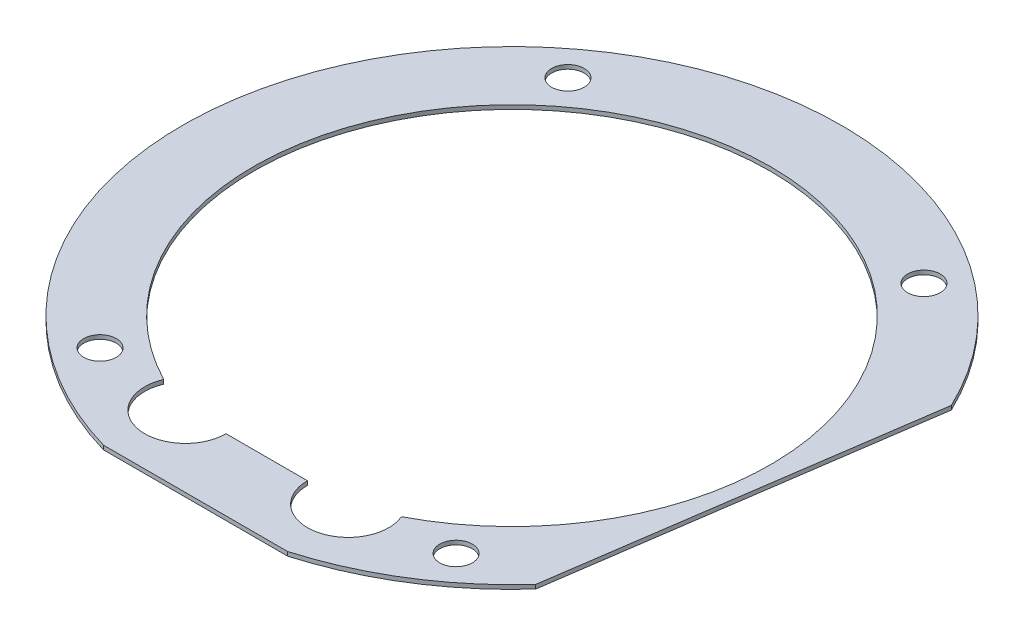
from build123d import *

# Parameters (mm, degrees)
SKETCH1_R           = 1.6
BOSS_EXTRUDE1_DEPTH = 0.4


with BuildPart() as part:
    # Sketch1 → Boss-Extrude1 (new body)
    with BuildSketch(Plane(origin=(0, 0, 0), x_dir=(1, 0, 0), z_dir=(0, 1, 0))):
        with BuildLine():
            Line((29.237843605, 13.960963482), (24.049079653, -21.711788683))
            ThreePointArc((24.049079653, -21.711788683), (17.208573183, -27.452231403), (9.060814288, -31.107260317))
            Line((9.060814288, -31.107260317), (-9.060814288, -31.107260317))
            ThreePointArc((-9.060814288, -31.107260317), (-24.689356555, 20.980840614), (29.237843605, 13.960963482))
        make_face()
        with Locations(Location((-17.5, 23, 0), (0, 0, 270))):
            Circle(SKETCH1_R, mode=Mode.SUBTRACT)
        with Locations(Location((-17.5, -23, 0), (0, 0, 270))):
            Circle(SKETCH1_R, mode=Mode.SUBTRACT)
        with Locations(Location((17.5, -23, 0), (0, 0, 270))):
            Circle(SKETCH1_R, mode=Mode.SUBTRACT)
        with Locations(Location((17.5, 23, 0), (0, 0, 270))):
            Circle(SKETCH1_R, mode=Mode.SUBTRACT)
        with BuildLine():
            Line((-4, -24.107260317), (4, -24.107260317))
            ThreePointArc((4, -24.107260317), (8.793181532, -28.027829543), (11.685431528, -22.552398764))
            ThreePointArc((11.685431528, -22.552398764), (0, 25.4), (-11.685431528, -22.552398764))
            ThreePointArc((-11.685431528, -22.552398764), (-8.793181532, -28.027829543), (-4, -24.107260317))
        make_face(mode=Mode.SUBTRACT)
    extrude(amount=BOSS_EXTRUDE1_DEPTH)


solid = part.part
